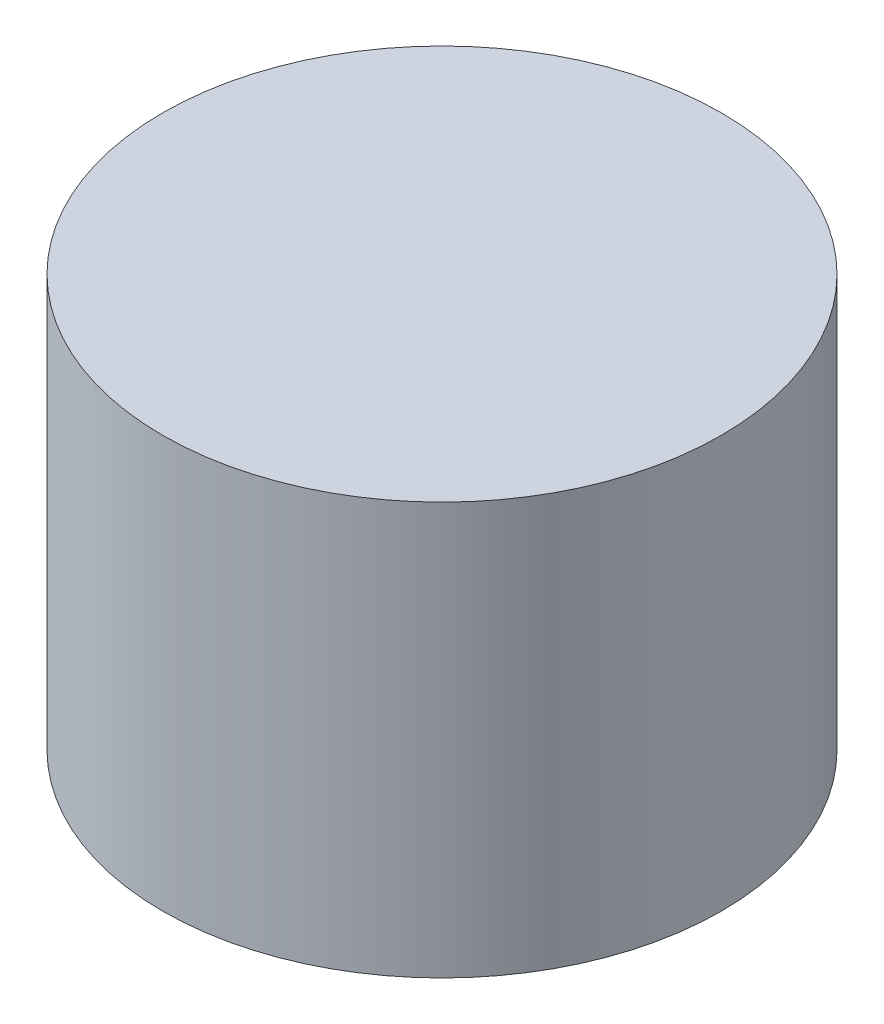
from build123d import *

# Parameters (mm, degrees)
SKETCH1_R           = 51.65
BOSS_EXTRUDE1_DEPTH = 76.2


with BuildPart() as part:
    # Sketch1 → Boss-Extrude1 (new body)
    with BuildSketch(Plane(origin=(0, 0, 0), x_dir=(1, 0, 0), z_dir=(0, 1, 0))):
        Circle(SKETCH1_R)
    extrude(amount=BOSS_EXTRUDE1_DEPTH)


solid = part.part
